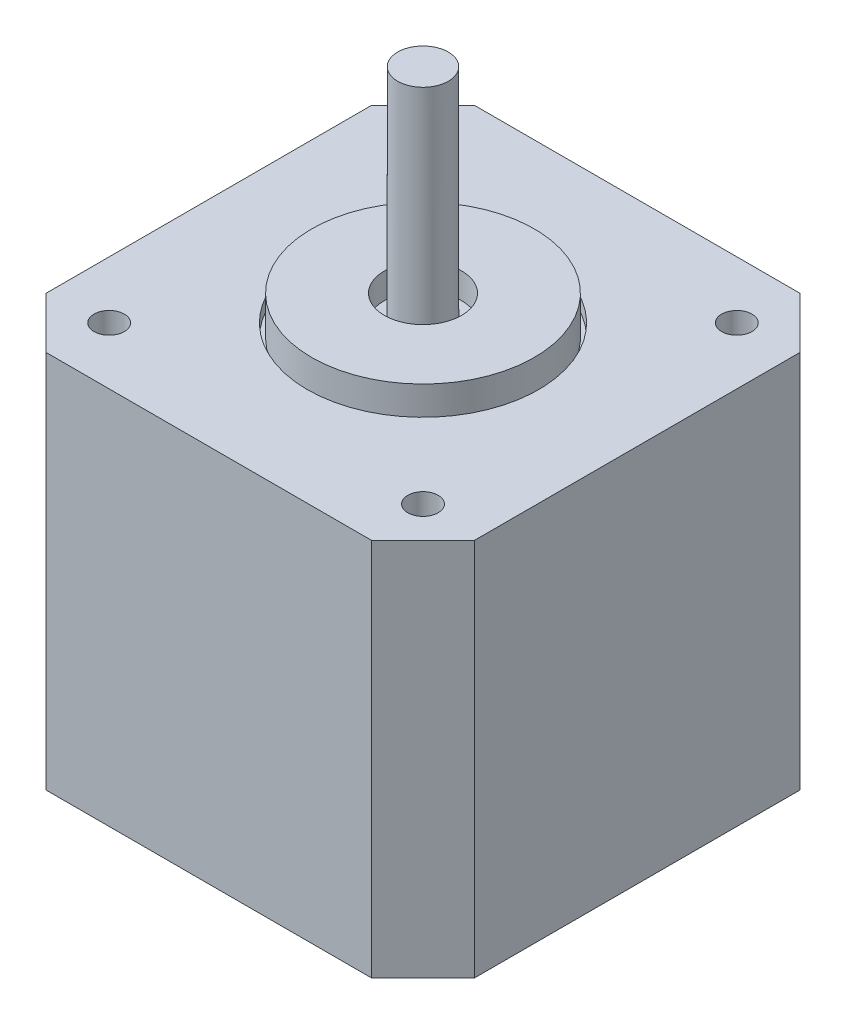
from build123d import *

# Parameters (mm, degrees)
SKETCH1_W           = 42.3
SKETCH1_H           = 42.3
BOSS_EXTRUDE1_DEPTH = 37.4396
CHAMFER1_SIZE       = 5.08
SKETCH2_R           = 11.43
SKETCH2_R_2         = 11
CUT_EXTRUDE1_DEPTH  = 1.27
BOSS_EXTRUDE2_START = 2.54
SKETCH3_R           = 11
SKETCH3_R_2         = 3.81
BOSS_EXTRUDE2_DEPTH = 2.54
SKETCH4_R           = 2.5
BOSS_EXTRUDE3_DEPTH = 21.9202
CUT_EXTRUDE2_REACH  = 49.92
SKETCH5_R           = 1.5


with BuildPart() as part:
    # Sketch1 → Boss-Extrude1 (new body)
    with BuildSketch(Plane(origin=(0, 0, 0), x_dir=(1, 0, 0), z_dir=(0, 1, 0))):
        Rectangle(SKETCH1_W, SKETCH1_H)
    extrude(amount=BOSS_EXTRUDE1_DEPTH)

    # Chamfer1
    chamfer1_edges = [part.edges().sort_by_distance(p)[0] for p in [
        (21.15, 18.7198, 21.15),
        (-21.15, 18.7198, 21.15),
        (-21.15, 18.7198, -21.15),
        (21.15, 18.7198, -21.15),
    ]]
    chamfer(chamfer1_edges, length=CHAMFER1_SIZE)

    # Sketch2 → Cut-Extrude1 (cut)
    with BuildSketch(Plane(origin=(0, 37.4396, 0), x_dir=(1, 0, 0), z_dir=(0, 1, 0))):
        with Locations(Location((0, 0, 0), (0, 0, 270))):
            Circle(SKETCH2_R)
        with Locations(Location((0, 0, 0), (0, 0, 270))):
            Circle(SKETCH2_R_2, mode=Mode.SUBTRACT)
    extrude(amount=-CUT_EXTRUDE1_DEPTH, mode=Mode.SUBTRACT)

    # Sketch3 → Boss-Extrude2 (add)
    with BuildSketch(Plane(origin=(0, 37.4396, 0), x_dir=(1, 0, 0), z_dir=(0, 1, 0)).offset(BOSS_EXTRUDE2_START)):
        with Locations(Location((0, 0, 0), (0, 0, 270))):
            Circle(SKETCH3_R)
        with Locations(Location((0, 0, 0), (0, 0, 270))):
            Circle(SKETCH3_R_2, mode=Mode.SUBTRACT)
    extrude(amount=-BOSS_EXTRUDE2_DEPTH)

    # Sketch4 → Boss-Extrude3 (add)
    with BuildSketch(Plane(origin=(0, 37.4396, 0), x_dir=(1, 0, 0), z_dir=(0, 1, 0))):
        with Locations(Location((0, 0, 0), (0, 0, 90))):
            Circle(SKETCH4_R)
    extrude(amount=BOSS_EXTRUDE3_DEPTH)

    # Sketch5 → Cut-Extrude2 (cut, up to next)
    with BuildSketch(Plane(origin=(0, 37.4396, 0), x_dir=(1, 0, 0), z_dir=(0, 1, 0)), mode=Mode.PRIVATE) as cut_extrude2_sk1:
        with Locations(Location((15.5, 15.5, 0), (0, 0, 270))):
            Circle(SKETCH5_R)
    cut_extrude2_tool1 = extrude(cut_extrude2_sk1.sketch, amount=-CUT_EXTRUDE2_REACH, mode=Mode.PRIVATE) & part.part
    # Sketch5 → Cut-Extrude2 (cut, up to next)
    with BuildSketch(Plane(origin=(0, 37.4396, 0), x_dir=(1, 0, 0), z_dir=(0, 1, 0)), mode=Mode.PRIVATE) as cut_extrude2_sk2:
        with Locations(Location((15.5, -15.5, 0), (0, 0, 270))):
            Circle(SKETCH5_R)
    cut_extrude2_tool2 = extrude(cut_extrude2_sk2.sketch, amount=-CUT_EXTRUDE2_REACH, mode=Mode.PRIVATE) & part.part
    # Sketch5 → Cut-Extrude2 (cut, up to next)
    with BuildSketch(Plane(origin=(0, 37.4396, 0), x_dir=(1, 0, 0), z_dir=(0, 1, 0)), mode=Mode.PRIVATE) as cut_extrude2_sk3:
        with Locations(Location((-15.5, -15.5, 0), (0, 0, 270))):
            Circle(SKETCH5_R)
    cut_extrude2_tool3 = extrude(cut_extrude2_sk3.sketch, amount=-CUT_EXTRUDE2_REACH, mode=Mode.PRIVATE) & part.part
    # Sketch5 → Cut-Extrude2 (cut, up to next)
    with BuildSketch(Plane(origin=(0, 37.4396, 0), x_dir=(1, 0, 0), z_dir=(0, 1, 0)), mode=Mode.PRIVATE) as cut_extrude2_sk4:
        with Locations(Location((-15.5, 15.5, 0), (0, 0, 270))):
            Circle(SKETCH5_R)
    cut_extrude2_tool4 = extrude(cut_extrude2_sk4.sketch, amount=-CUT_EXTRUDE2_REACH, mode=Mode.PRIVATE) & part.part
    add(cut_extrude2_tool1.solids().sort_by_distance((15.5, 37.4396, -15.5))[0], mode=Mode.SUBTRACT)
    add(cut_extrude2_tool2.solids().sort_by_distance((15.5, 37.4396, 15.5))[0], mode=Mode.SUBTRACT)
    add(cut_extrude2_tool3.solids().sort_by_distance((-15.5, 37.4396, 15.5))[0], mode=Mode.SUBTRACT)
    add(cut_extrude2_tool4.solids().sort_by_distance((-15.5, 37.4396, -15.5))[0], mode=Mode.SUBTRACT)


solid = part.part
